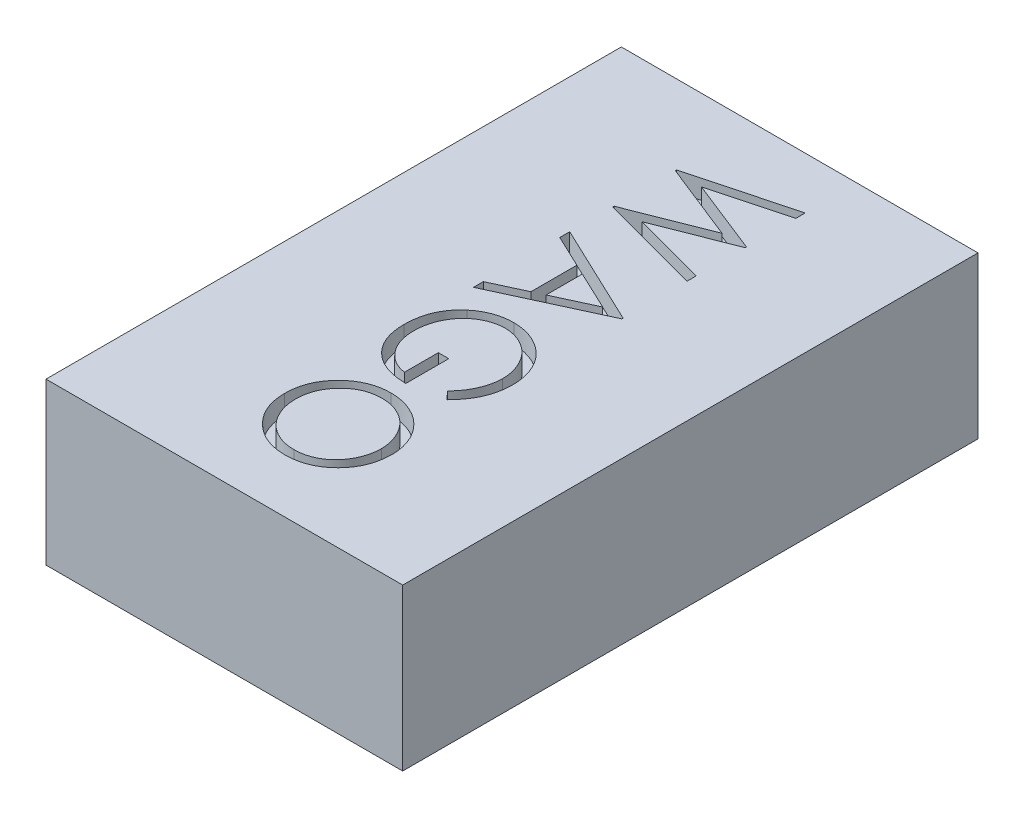
from build123d import *

# Parameters (mm, degrees)
SKETCH1_W           = 18.6
SKETCH1_H           = 30
BOSS_EXTRUDE1_DEPTH = 8.4
CUT_EXTRUDE1_DEPTH  = 1


with BuildPart() as part:
    # Sketch1 → Boss-Extrude1 (new body)
    with BuildSketch(Plane(origin=(0, 0, 0), x_dir=(1, 0, 0), z_dir=(0, 1, 0))):
        Rectangle(SKETCH1_W, SKETCH1_H)
    extrude(amount=BOSS_EXTRUDE1_DEPTH)

    # Sketch2 → Cut-Extrude1 (cut)
    # profile 1 of 4: a face of its own
    with BuildSketch(Plane(origin=(0, 8.4, 0), x_dir=(1, 0, 0), z_dir=(0, 1, 0))):
        Polygon((2.991666667, 12.29786164), (2.991666667, 11.808128066), (-0.892280983, 10.771419332), (2.991666667, 9.232256672), (2.991666667, 9.163354762), (-0.86260016, 7.650692836), (2.991666667, 6.609743985), (2.991666667, 6.124250529), (-2.3, 7.551050075), (-2.3, 7.618891955), (1.745072115, 9.211056084), (-2.3, 10.820180684), (-2.3, 10.889082593), align=None)
    # profile 2 of 4: a face of its own
    with BuildSketch(Plane(origin=(0, 8.4, 0), x_dir=(1, 0, 0), z_dir=(0, 1, 0))):
        Polygon((2.991666667, 2.732156512), (-2.3, 0.289848819), (-2.3, 0.806083127), (-0.603952991, 1.58838481), (-0.603952991, 3.987231298), (-2.3, 4.790733568), (-2.3, 5.310147965), (2.991666667, 2.799998392), align=None)
        Polygon((1.95919805, 2.771377599), (-0.061217949, 3.728584129), (-0.061217949, 1.838551744), align=None, mode=Mode.SUBTRACT)
    # profile 3 of 4: a face of its own
    with BuildSketch(Plane(origin=(0, 8.4, 0), x_dir=(1, 0, 0), z_dir=(0, 1, 0))):
        with BuildLine():
            Line((2.088521635, -5.47671101), (1.70267094, -5.069659728))
            add(Edge.make_bspline(
                [(1.70267094, -5.069659728), (1.771844395, -4.995555288), (1.908174598, -4.849506873), (2.087317011, -4.612944084), (2.23808531, -4.364797852), (2.362892726, -4.108758993), (2.46157366, -3.849398167), (2.531452139, -3.590875425), (2.576709056, -3.335981936), (2.582001932, -3.166733911), (2.584615385, -3.083164669)],
                knots=[0, 0, 0, 0, 1.09204548, 2.152253107, 3.191356492, 4.216655925, 5.218178745, 6.177092199, 7.099906635, 8, 8, 8, 8], degree=3))
            add(Edge.make_bspline(
                [(2.584615385, -3.083164669), (2.583989128, -3.03188916), (2.58273824, -2.929471129), (2.566810135, -2.777336049), (2.543830709, -2.626816856), (2.510923953, -2.47843261), (2.468183639, -2.331593356), (2.416581091, -2.186625744), (2.354462606, -2.0438096), (2.283641938, -1.903896098), (2.206329192, -1.767563588), (2.120103818, -1.639340535), (2.02761369, -1.518699757), (1.927666261, -1.406466848), (1.821850032, -1.301206329), (1.708725215, -1.204285833), (1.589112903, -1.115219229), (1.463024142, -1.035032881), (1.333325174, -0.963436647), (1.201199056, -0.900107125), (1.066783497, -0.847462625), (0.930857049, -0.803775679), (0.793136307, -0.76955005), (0.653617666, -0.745063839), (0.511824896, -0.731356687), (0.416882744, -0.728976127), (0.36915398, -0.727779386)],
                knots=[0, 0, 0, 0, 1.028345126, 2.054023193, 3.065714254, 4.082262095, 5.100859654, 6.132352297, 7.167492809, 8.223256921, 9.277568108, 10.309840045, 11.320860232, 12.32524711, 13.322830633, 14.313234294, 15.3114222, 16.312425732, 17.308799391, 18.282312954, 19.249923241, 20.202773571, 21.145015718, 22.094907699, 23.042283124, 24, 24, 24, 24], degree=3))
            add(Edge.make_bspline(
                [(0.36915398, -0.727779386), (0.320366302, -0.728932141), (0.222924168, -0.731234504), (0.077447213, -0.74568795), (-0.065590228, -0.773353039), (-0.207779454, -0.80743219), (-0.347278385, -0.854896311), (-0.485649147, -0.910858903), (-0.621625848, -0.977944155), (-0.754381228, -1.05536496), (-0.883680171, -1.140325061), (-1.005479488, -1.235485829), (-1.121395113, -1.33657351), (-1.228854969, -1.447265728), (-1.330732984, -1.564014383), (-1.424222409, -1.690307212), (-1.511124007, -1.823660937), (-1.590342555, -1.964278982), (-1.661112603, -2.11063557), (-1.724043969, -2.260702328), (-1.775871063, -2.414958668), (-1.818110815, -2.572593925), (-1.852733884, -2.733420181), (-1.875007991, -2.898253787), (-1.891171509, -3.065882763), (-1.89235332, -3.178880457), (-1.892948718, -3.2358089)],
                knots=[0, 0, 0, 0, 0.935842715, 1.869129955, 2.799583258, 3.728257868, 4.6712142, 5.62263184, 6.589468525, 7.576334199, 8.568768874, 9.554260682, 10.538610026, 11.516240982, 12.510802173, 13.508383516, 14.52719334, 15.561971611, 16.601598616, 17.64369662, 18.68095744, 19.719943675, 20.77263142, 21.833597991, 22.908562741, 24, 24, 24, 24], degree=3))
            add(Edge.make_bspline(
                [(-1.892948718, -3.2358089), (-1.891514561, -3.304416639), (-1.888698361, -3.439139082), (-1.866775302, -3.637178105), (-1.832535516, -3.827380381), (-1.782391806, -4.009211374), (-1.718432797, -4.182882584), (-1.641332192, -4.349029544), (-1.548135386, -4.506348353), (-1.442940234, -4.65529624), (-1.325767501, -4.792548245), (-1.199224747, -4.916175087), (-1.064550062, -5.024840943), (-0.920553916, -5.117641899), (-0.769538916, -5.197589317), (-0.608815781, -5.261343892), (-0.440206757, -5.310659847), (-0.323641932, -5.330833716), (-0.26474359, -5.341027249)],
                knots=[0, 0, 0, 0, 1.13011591, 2.219166196, 3.278784489, 4.311187005, 5.322345388, 6.325022048, 7.324448642, 8.33076908, 9.325913853, 10.293360401, 11.241630175, 12.171712957, 13.111744789, 14.052245185, 15.015830637, 16, 16, 16, 16], degree=3))
            Line((-0.26474359, -5.341027249), (-0.26474359, -3.57713836))
            Line((-0.26474359, -3.57713836), (0.277991453, -3.57713836))
            Line((0.277991453, -3.57713836), (0.277991453, -5.815920412))
            add(Edge.make_bspline(
                [(0.277991453, -5.815920412), (0.176833702, -5.813341331), (-0.02115029, -5.808293605), (-0.309879152, -5.772886435), (-0.582583974, -5.71571147), (-0.839551951, -5.637605999), (-1.08041893, -5.536496944), (-1.305429466, -5.413469431), (-1.513129924, -5.266554438), (-1.705215918, -5.10098508), (-1.876558893, -4.915172049), (-2.027153585, -4.714136159), (-2.154006349, -4.497545266), (-2.257209969, -4.265604248), (-2.337755176, -4.019072402), (-2.394862203, -3.757379256), (-2.429076552, -3.480879694), (-2.433448042, -3.291382575), (-2.435683761, -3.194467754)],
                knots=[0, 0, 0, 0, 1.140356446, 2.231883559, 3.274166699, 4.278491846, 5.25512956, 6.21435461, 7.1637429, 8.11826594, 9.068280886, 10.0076534, 10.945064095, 11.891975133, 12.864533718, 13.863980011, 14.907571808, 16, 16, 16, 16], degree=3))
            add(Edge.make_bspline(
                [(-2.435683761, -3.194467754), (-2.434823304, -3.134732192), (-2.433126205, -3.016914412), (-2.421065215, -2.84290789), (-2.402498154, -2.673699106), (-2.374459693, -2.509312712), (-2.340117299, -2.349144028), (-2.296140951, -2.193992989), (-2.245237084, -2.043268569), (-2.187337673, -1.896737805), (-2.120251954, -1.755730693), (-2.045700475, -1.619619173), (-1.964067656, -1.487650864), (-1.873941734, -1.360724698), (-1.775996824, -1.238179341), (-1.670036613, -1.120804968), (-1.556385039, -1.007944486), (-1.475681061, -0.937247119), (-1.435016026, -0.901624204)],
                knots=[0, 0, 0, 0, 1.107784379, 2.184907829, 3.233506516, 4.263428166, 5.276301166, 6.270063455, 7.25232949, 8.225834625, 9.190232166, 10.146266622, 11.1027726, 12.066435141, 13.031522626, 14.010570082, 14.99756817, 16, 16, 16, 16], degree=3))
            add(Edge.make_bspline(
                [(-1.435016026, -0.901624204), (-1.370502062, -0.849938331), (-1.242545001, -0.747424517), (-1.037530799, -0.615468256), (-0.825256558, -0.502980421), (-0.605131346, -0.411710023), (-0.37736106, -0.340441726), (-0.14223675, -0.289329891), (0.100544358, -0.259383157), (0.264835889, -0.25506888), (0.347953392, -0.252886224)],
                knots=[0, 0, 0, 0, 1.023165419, 2.029347347, 3.013907458, 3.994755782, 4.975994455, 5.96558838, 6.970761222, 8, 8, 8, 8], degree=3))
            add(Edge.make_bspline(
                [(0.347953392, -0.252886224), (0.410192191, -0.253693097), (0.533878772, -0.25529659), (0.717520282, -0.274655472), (0.89785555, -0.302596654), (1.075051599, -0.343068337), (1.248321572, -0.396319088), (1.418997559, -0.460270602), (1.586394763, -0.535178234), (1.749039367, -0.622584324), (1.906838775, -0.717755582), (2.054961886, -0.824660248), (2.195971361, -0.938034224), (2.327312989, -1.061082913), (2.449558737, -1.193109245), (2.563161546, -1.333382174), (2.66841177, -1.481833149), (2.763614463, -1.638976933), (2.849133731, -1.802455103), (2.924107773, -1.971879311), (2.986070676, -2.147196889), (3.03864531, -2.327094634), (3.077524156, -2.512934186), (3.105719282, -2.703366962), (3.125012094, -2.899385584), (3.126563695, -3.031882914), (3.127350427, -3.09906511)],
                knots=[0, 0, 0, 0, 1.009014138, 2.005204323, 2.991638015, 3.967544938, 4.950092358, 5.929358695, 6.922031709, 7.921874511, 8.922406847, 9.908357674, 10.882125353, 11.855201406, 12.82437151, 13.798139189, 14.780770167, 15.773426639, 16.775664355, 17.771244468, 18.775446331, 19.789330884, 20.808771541, 21.851841802, 22.910785716, 24, 24, 24, 24], degree=3))
            add(Edge.make_bspline(
                [(3.127350427, -3.09906511), (3.126476481, -3.153854284), (3.124743547, -3.262494777), (3.112669713, -3.424150436), (3.09374489, -3.582989157), (3.067281693, -3.739807739), (3.032275174, -3.89400908), (2.989612357, -4.046060364), (2.940217059, -4.195674008), (2.881261139, -4.342672025), (2.81435619, -4.488053834), (2.739042402, -4.632624813), (2.654035727, -4.775891806), (2.559082713, -4.918103041), (2.455814464, -5.060155353), (2.341277358, -5.199801895), (2.219988192, -5.340413489), (2.132778224, -5.430828137), (2.088521635, -5.47671101)],
                knots=[0, 0, 0, 0, 0.985875312, 1.954874891, 2.915472732, 3.863573565, 4.815313299, 5.759461513, 6.704487138, 7.649063459, 8.607849844, 9.583336382, 10.581114205, 11.603942397, 12.659508253, 13.739925933, 14.853076422, 16, 16, 16, 16], degree=3))
        make_face()
    # profile 4 of 4: a face of its own
    with BuildSketch(Plane(origin=(0, 8.4, 0), x_dir=(1, 0, 0), z_dir=(0, 1, 0))):
        with BuildLine():
            add(Edge.make_bspline(
                [(3.127350427, -9.37761913), (3.124868644, -9.475602794), (3.119994218, -9.668050794), (3.082682085, -9.950890503), (3.018129544, -10.220908252), (2.932162425, -10.480309706), (2.817461954, -10.725969783), (2.678902209, -10.959820895), (2.514512541, -11.181201855), (2.327051335, -11.388083439), (2.122342404, -11.576704716), (1.903251301, -11.741501826), (1.672778135, -11.880836537), (1.43012092, -11.995039431), (1.176347679, -12.084713696), (0.910015501, -12.146573826), (0.632874364, -12.186093741), (0.443845498, -12.190713576), (0.347953392, -12.193057164)],
                knots=[0, 0, 0, 0, 1.06508495, 2.091914715, 3.094501328, 4.079693967, 5.057647778, 6.035986298, 7.030177474, 8.050107388, 9.066943579, 10.051896531, 11.025616101, 11.9896488, 12.96281505, 13.945825876, 14.957941789, 16, 16, 16, 16], degree=3))
            add(Edge.make_bspline(
                [(0.347953392, -12.193057164), (0.252767647, -12.190713923), (0.065145516, -12.186095126), (-0.210236847, -12.146528847), (-0.474961626, -12.084484562), (-0.728561192, -11.995871272), (-0.971398421, -11.882217011), (-1.202295221, -11.741940599), (-1.422903333, -11.578234553), (-1.628606032, -11.390265229), (-1.817597853, -11.185605116), (-1.982651178, -10.965896192), (-2.123701431, -10.735649845), (-2.237121017, -10.493139322), (-2.32742993, -10.241068212), (-2.389060476, -9.977126293), (-2.428799499, -9.702491298), (-2.433363826, -9.515210511), (-2.435683761, -9.420020305)],
                knots=[0, 0, 0, 0, 1.04355943, 2.056976533, 3.044937463, 4.02179873, 4.997890911, 5.980248884, 6.980147982, 8.006253959, 9.032111064, 10.031228745, 11.015595249, 11.988180414, 12.962670953, 13.946861971, 14.95644057, 16, 16, 16, 16], degree=3))
            add(Edge.make_bspline(
                [(-2.435683761, -9.420020305), (-2.43334155, -9.324128587), (-2.428724428, -9.135100486), (-2.38913613, -8.857612657), (-2.327253308, -8.591087638), (-2.238732143, -8.336346054), (-2.124759617, -8.093304312), (-1.984704307, -7.861985916), (-1.81966836, -7.642112901), (-1.631949293, -7.435922729), (-1.427190823, -7.247492786), (-1.208926056, -7.08175777), (-0.979230814, -6.942509909), (-0.739051945, -6.82848927), (-0.48901027, -6.738303285), (-0.227532933, -6.676755777), (0.043914865, -6.636939872), (0.228734325, -6.632351261), (0.322512687, -6.630022976)],
                knots=[0, 0, 0, 0, 1.053167129, 2.076072758, 3.073341244, 4.055601477, 5.033424535, 6.017524495, 7.021518915, 8.049444456, 9.077120685, 10.074910483, 11.055688766, 12.022980584, 12.991883888, 13.970269434, 14.970104079, 16, 16, 16, 16], degree=3))
            add(Edge.make_bspline(
                [(0.322512687, -6.630022976), (0.385457605, -6.630830552), (0.510553364, -6.632435518), (0.696311729, -6.651786244), (0.879102754, -6.679808896), (1.058311984, -6.720179822), (1.233968684, -6.772254893), (1.405713626, -6.836428583), (1.574961484, -6.909971657), (1.73849117, -6.997534845), (1.896559356, -7.093068904), (2.047189531, -7.197239196), (2.187691033, -7.310772046), (2.320321497, -7.432045663), (2.442817221, -7.562738746), (2.557848894, -7.700884368), (2.664225752, -7.84720537), (2.759713587, -8.001933162), (2.847420324, -8.1611229), (2.920648231, -8.325929513), (2.985371881, -8.492875749), (3.036807989, -8.663432134), (3.077741151, -8.837204143), (3.1055542, -9.014409011), (3.124947923, -9.194864219), (3.126546147, -9.316438726), (3.127350427, -9.37761913)],
                knots=[0, 0, 0, 0, 1.037115869, 2.061148057, 3.07517727, 4.084041727, 5.086514338, 6.092668487, 7.104487461, 8.125783165, 9.147610153, 10.147694368, 11.141876323, 12.122903372, 13.107606018, 14.091946891, 15.084523921, 16.086505767, 17.087268121, 18.077809654, 19.05670789, 20.036870126, 21.011670792, 21.99694167, 22.991993299, 24, 24, 24, 24], degree=3))
        make_face()
        with BuildLine():
            add(Edge.make_bspline(
                [(2.584615385, -9.400939776), (2.584003521, -9.350722299), (2.582785642, -9.250767427), (2.566731382, -9.102172263), (2.543872654, -8.955523315), (2.511182921, -8.810828563), (2.467052968, -8.668866665), (2.415055231, -8.528219938), (2.353887774, -8.389563719), (2.282564996, -8.254448086), (2.204652606, -8.123098884), (2.119141059, -7.998306214), (2.026444993, -7.881314967), (1.927788863, -7.771750378), (1.822168881, -7.669931716), (1.71127075, -7.573795048), (1.591901995, -7.48720961), (1.467305582, -7.407856224), (1.337642166, -7.336845374), (1.204277275, -7.273700121), (1.06612291, -7.222047398), (0.924677935, -7.179922137), (0.780166358, -7.144997423), (0.63149192, -7.122872324), (0.479401692, -7.106646018), (0.376619603, -7.105497205), (0.324632746, -7.104916138)],
                knots=[0, 0, 0, 0, 1.008585988, 2.007529826, 2.999688727, 3.990042337, 4.984966365, 5.984641633, 7.001812546, 8.027570247, 9.052811818, 10.068991095, 11.064725446, 12.050001529, 13.029093193, 14.010961114, 14.996492974, 15.989185205, 16.977398719, 17.96520407, 18.951579521, 19.937648295, 20.929603947, 21.935788061, 22.955928099, 24, 24, 24, 24], degree=3))
            add(Edge.make_bspline(
                [(0.324632746, -7.104916138), (0.248187483, -7.106843608), (0.097796003, -7.110635537), (-0.122591548, -7.143833292), (-0.334391695, -7.194968896), (-0.536445534, -7.270348486), (-0.730489866, -7.364616677), (-0.91480331, -7.481074), (-1.08943568, -7.619049046), (-1.253167813, -7.775778425), (-1.402613255, -7.947111565), (-1.533791266, -8.129043192), (-1.644780572, -8.319624242), (-1.735200146, -8.519351703), (-1.806848916, -8.727159292), (-1.855953513, -8.944386065), (-1.888271166, -9.169584974), (-1.891374737, -9.323089655), (-1.892948718, -9.400939776)],
                knots=[0, 0, 0, 0, 1.032063989, 2.030389145, 3.003944642, 3.970395727, 4.937377036, 5.913328081, 6.909231446, 7.93887556, 8.970685674, 9.976071282, 10.964166581, 11.944589148, 12.933237628, 13.927779006, 14.949070134, 16, 16, 16, 16], degree=3))
            add(Edge.make_bspline(
                [(-1.892948718, -9.400939776), (-1.892229803, -9.453266048), (-1.890803978, -9.55704476), (-1.876442852, -9.711403445), (-1.853413833, -9.862981371), (-1.82025634, -10.011565443), (-1.77876037, -10.156988839), (-1.72945466, -10.299851806), (-1.66797089, -10.438657804), (-1.599929615, -10.575062761), (-1.522920046, -10.705653195), (-1.438603779, -10.829551784), (-1.347565481, -10.946040238), (-1.249766066, -11.055370864), (-1.146048593, -11.157895016), (-1.033746315, -11.250828732), (-0.916138972, -11.338451449), (-0.791251938, -11.417487096), (-0.661315284, -11.488356764), (-0.527445224, -11.549982334), (-0.390101823, -11.602295962), (-0.249052302, -11.644519155), (-0.104573818, -11.677608442), (0.04352958, -11.700407694), (0.194960936, -11.716355969), (0.297383199, -11.717558045), (0.349013421, -11.718164001)],
                knots=[0, 0, 0, 0, 1.047226202, 2.076964084, 3.100341814, 4.114585567, 5.122123135, 6.126552355, 7.137064942, 8.158803602, 9.176592812, 10.169297945, 11.156925011, 12.133779169, 13.104132798, 14.073170763, 15.049307625, 16.038276215, 17.028988595, 18.010110019, 18.986169996, 19.968539974, 20.955178716, 21.950601663, 22.966915103, 24, 24, 24, 24], degree=3))
            add(Edge.make_bspline(
                [(0.349013421, -11.718164001), (0.400290434, -11.717557557), (0.502007834, -11.716354562), (0.652383118, -11.700415344), (0.799420712, -11.677584236), (0.942543367, -11.644681094), (1.081787565, -11.602271933), (1.217022529, -11.549979184), (1.348752062, -11.488315695), (1.476650582, -11.417546118), (1.599379056, -11.337996004), (1.716706512, -11.251070184), (1.826429589, -11.155267813), (1.931257028, -11.053326081), (2.028953178, -10.942698687), (2.119550113, -10.823886658), (2.205235504, -10.698332755), (2.282529431, -10.565394275), (2.353924285, -10.42820133), (2.415040252, -10.287409846), (2.46727785, -10.144368122), (2.511002289, -9.999808525), (2.543904681, -9.852712691), (2.566723181, -9.703937222), (2.582787361, -9.55322782), (2.58400411, -9.451863545), (2.584615385, -9.400939776)],
                knots=[0, 0, 0, 0, 1.029967493, 2.04313025, 3.035375922, 4.01889446, 4.991458755, 5.958017022, 6.930036849, 7.912118993, 8.892942568, 9.867138445, 10.843712051, 11.817804417, 12.803729339, 13.806387533, 14.818654169, 15.856205545, 16.894655496, 17.924916651, 18.938004761, 19.953404357, 20.957695443, 21.963967554, 22.97713031, 24, 24, 24, 24], degree=3))
        make_face(mode=Mode.SUBTRACT)
    extrude(amount=-CUT_EXTRUDE1_DEPTH, mode=Mode.SUBTRACT)


solid = part.part
